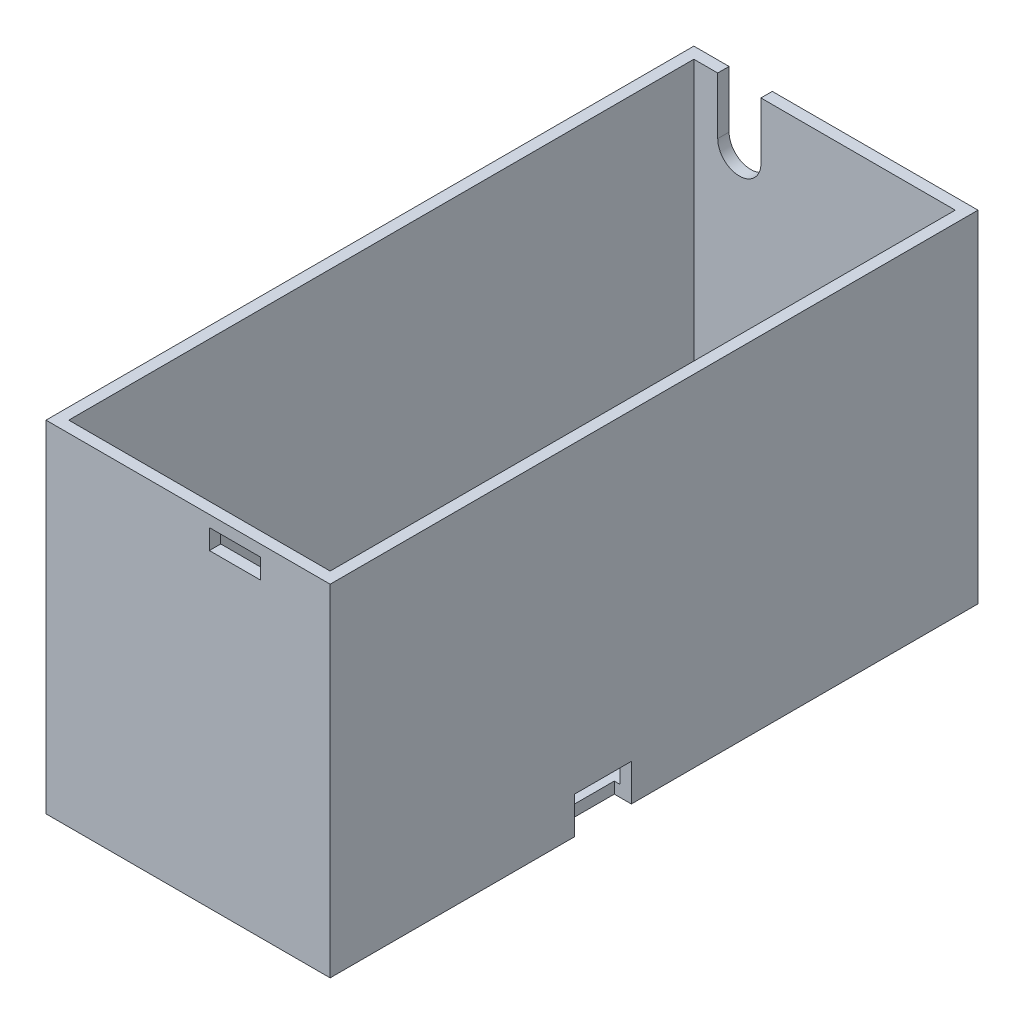
from build123d import *

# Parameters (mm, degrees)
SKIZZE1_W                       = 50
SKIZZE1_H                       = 114
AUFSATZ_LINEAR_AUSTRAGEN1_DEPTH = 60
SKIZZE2_W                       = 46
SKIZZE2_H                       = 110
SCHNITT_LINEAR_AUSTRAGEN1_DEPTH = 58
SKIZZE3_R                       = 2
AUFSATZ_LINEAR_AUSTRAGEN2_DEPTH = 15.2
SKIZZE4_R                       = 0.5
SCHNITT_LINEAR_AUSTRAGEN2_DEPTH = 5
SCHNITT_LINEAR_AUSTRAGEN3_REACH = 123.846
SKIZZE5_W                       = 15.5
SKIZZE5_H                       = 20.2
SKIZZE6_W                       = 15.5
SKIZZE6_H                       = 2
AUFSATZ_LINEAR_AUSTRAGEN3_DEPTH = 1
SCHNITT_LINEAR_AUSTRAGEN4_REACH = 123.846
SKIZZE7_W                       = 40
SKIZZE7_H                       = 3.1
FASE1_SIZE                      = 1.5
SKIZZE8_W                       = 10
SKIZZE8_H                       = 6.5
SCHNITT_LINEAR_AUSTRAGEN5_DEPTH = 3
SCHNITT_LINEAR_AUSTRAGEN6_REACH = 133.996
SKIZZE9_R                       = 3.8
SCHNITT_LINEAR_AUSTRAGEN7_REACH = 133.996
SKIZZE10_W                      = 9
SKIZZE10_H                      = 3.5


with BuildPart() as part:
    # Skizze1 → Aufsatz-Linear austragen1 (new body)
    with BuildSketch(Plane(origin=(0, 0, 0), x_dir=(1, 0, 0), z_dir=(0, 1, 0))):
        with Locations((3.757679181, -46.225255973)):
            Rectangle(SKIZZE1_W, SKIZZE1_H)
    extrude(amount=AUFSATZ_LINEAR_AUSTRAGEN1_DEPTH)

    # Skizze2 → Schnitt-Linear austragen1 (cut)
    with BuildSketch(Plane(origin=(0, 60, 0), x_dir=(1, 0, 0), z_dir=(0, 1, 0))):
        with Locations((3.757679181, -46.225255973)):
            Rectangle(SKIZZE2_W, SKIZZE2_H)
    extrude(amount=-SCHNITT_LINEAR_AUSTRAGEN1_DEPTH, mode=Mode.SUBTRACT)

    # Skizze3 → Aufsatz-Linear austragen2 (add)
    with BuildSketch(Plane(origin=(0, 2, 0), x_dir=(1, 0, 0), z_dir=(0, 1, 0))):
        with Locations(Location((-11.242320819, -24.225255973, 0), (0, 0, 90))):
            Circle(SKIZZE3_R)
        with Locations(Location((18.757679181, -24.225255973, 0), (0, 0, 90))):
            Circle(SKIZZE3_R)
        with Locations(Location((18.757679181, -96.225255973, 0), (0, 0, 90))):
            Circle(SKIZZE3_R)
        with Locations(Location((-11.242320819, -96.225255973, 0), (0, 0, 90))):
            Circle(SKIZZE3_R)
    extrude(amount=AUFSATZ_LINEAR_AUSTRAGEN2_DEPTH)

    # Skizze4 → Schnitt-Linear austragen2 (cut)
    with BuildSketch(Plane(origin=(0, 17.2, 0), x_dir=(1, 0, 0), z_dir=(0, 1, 0))):
        with Locations(Location((-11.242320819, -24.225255973, 0), (0, 0, 270))):
            Circle(SKIZZE4_R)
        with Locations(Location((18.757679181, -24.225255973, 0), (0, 0, 270))):
            Circle(SKIZZE4_R)
        with Locations(Location((18.757679181, -96.225255973, 0), (0, 0, 270))):
            Circle(SKIZZE4_R)
        with Locations(Location((-11.242320819, -96.225255973, 0), (0, 0, 270))):
            Circle(SKIZZE4_R)
    extrude(amount=-SCHNITT_LINEAR_AUSTRAGEN2_DEPTH, mode=Mode.SUBTRACT)

    # Skizze5 → Schnitt-Linear austragen3 (cut, up to next)
    with BuildSketch(Plane(origin=(0, 2, 0), x_dir=(1, 0, 0), z_dir=(0, 1, 0)), mode=Mode.PRIVATE) as schnitt_linear_austragen3_sk1:
        with Locations((3.757679181, -17.825255973)):
            Rectangle(SKIZZE5_W, SKIZZE5_H)
    schnitt_linear_austragen3_tool1 = extrude(schnitt_linear_austragen3_sk1.sketch, amount=-SCHNITT_LINEAR_AUSTRAGEN3_REACH, mode=Mode.PRIVATE) & part.part
    add(schnitt_linear_austragen3_tool1.solids().sort_by_distance((3.757679, 2, 17.825256))[0], mode=Mode.SUBTRACT)

    # Skizze6 → Aufsatz-Linear austragen3 (add)
    with BuildSketch(Plane(origin=(0, 2, 0), x_dir=(1, 0, 0), z_dir=(0, 1, 0))):
        with Locations((3.757679181, -28.925255973)):
            Rectangle(SKIZZE6_W, SKIZZE6_H)
    extrude(amount=AUFSATZ_LINEAR_AUSTRAGEN3_DEPTH)

    # Skizze7 → Schnitt-Linear austragen4 (cut, up to next)
    with BuildSketch(Plane(origin=(0, 2, 0), x_dir=(1, 0, 0), z_dir=(0, 1, 0)), mode=Mode.PRIVATE) as schnitt_linear_austragen4_sk1:
        with Locations((3.757679181, -34.775255973)):
            Rectangle(SKIZZE7_W, SKIZZE7_H)
    schnitt_linear_austragen4_tool1 = extrude(schnitt_linear_austragen4_sk1.sketch, amount=-SCHNITT_LINEAR_AUSTRAGEN4_REACH, mode=Mode.PRIVATE) & part.part
    # Skizze7 → Schnitt-Linear austragen4 (cut, up to next)
    with BuildSketch(Plane(origin=(0, 2, 0), x_dir=(1, 0, 0), z_dir=(0, 1, 0)), mode=Mode.PRIVATE) as schnitt_linear_austragen4_sk2:
        with Locations((3.757679181, -38.875255973)):
            Rectangle(SKIZZE7_W, SKIZZE7_H)
    schnitt_linear_austragen4_tool2 = extrude(schnitt_linear_austragen4_sk2.sketch, amount=-SCHNITT_LINEAR_AUSTRAGEN4_REACH, mode=Mode.PRIVATE) & part.part
    # Skizze7 → Schnitt-Linear austragen4 (cut, up to next)
    with BuildSketch(Plane(origin=(0, 2, 0), x_dir=(1, 0, 0), z_dir=(0, 1, 0)), mode=Mode.PRIVATE) as schnitt_linear_austragen4_sk3:
        with Locations((3.757679181, -42.975255973)):
            Rectangle(SKIZZE7_W, SKIZZE7_H)
    schnitt_linear_austragen4_tool3 = extrude(schnitt_linear_austragen4_sk3.sketch, amount=-SCHNITT_LINEAR_AUSTRAGEN4_REACH, mode=Mode.PRIVATE) & part.part
    # Skizze7 → Schnitt-Linear austragen4 (cut, up to next)
    with BuildSketch(Plane(origin=(0, 2, 0), x_dir=(1, 0, 0), z_dir=(0, 1, 0)), mode=Mode.PRIVATE) as schnitt_linear_austragen4_sk4:
        with Locations((3.757679181, -47.075255973)):
            Rectangle(SKIZZE7_W, SKIZZE7_H)
    schnitt_linear_austragen4_tool4 = extrude(schnitt_linear_austragen4_sk4.sketch, amount=-SCHNITT_LINEAR_AUSTRAGEN4_REACH, mode=Mode.PRIVATE) & part.part
    # Skizze7 → Schnitt-Linear austragen4 (cut, up to next)
    with BuildSketch(Plane(origin=(0, 2, 0), x_dir=(1, 0, 0), z_dir=(0, 1, 0)), mode=Mode.PRIVATE) as schnitt_linear_austragen4_sk5:
        with Locations((3.757679181, -51.175255973)):
            Rectangle(SKIZZE7_W, SKIZZE7_H)
    schnitt_linear_austragen4_tool5 = extrude(schnitt_linear_austragen4_sk5.sketch, amount=-SCHNITT_LINEAR_AUSTRAGEN4_REACH, mode=Mode.PRIVATE) & part.part
    # Skizze7 → Schnitt-Linear austragen4 (cut, up to next)
    with BuildSketch(Plane(origin=(0, 2, 0), x_dir=(1, 0, 0), z_dir=(0, 1, 0)), mode=Mode.PRIVATE) as schnitt_linear_austragen4_sk6:
        with Locations((3.757679181, -55.275255973)):
            Rectangle(SKIZZE7_W, SKIZZE7_H)
    schnitt_linear_austragen4_tool6 = extrude(schnitt_linear_austragen4_sk6.sketch, amount=-SCHNITT_LINEAR_AUSTRAGEN4_REACH, mode=Mode.PRIVATE) & part.part
    add(schnitt_linear_austragen4_tool1.solids().sort_by_distance((3.757679, 2, 34.775256))[0], mode=Mode.SUBTRACT)
    add(schnitt_linear_austragen4_tool2.solids().sort_by_distance((3.757679, 2, 38.875256))[0], mode=Mode.SUBTRACT)
    add(schnitt_linear_austragen4_tool3.solids().sort_by_distance((3.757679, 2, 42.975256))[0], mode=Mode.SUBTRACT)
    add(schnitt_linear_austragen4_tool4.solids().sort_by_distance((3.757679, 2, 47.075256))[0], mode=Mode.SUBTRACT)
    add(schnitt_linear_austragen4_tool5.solids().sort_by_distance((3.757679, 2, 51.175256))[0], mode=Mode.SUBTRACT)
    add(schnitt_linear_austragen4_tool6.solids().sort_by_distance((3.757679, 2, 55.275256))[0], mode=Mode.SUBTRACT)

    # Fase1
    fase1_edges = [part.edges().sort_by_distance(p)[0] for p in [
        (-16.242320819, 1, 36.325255973),
        (-16.242320819, 1, 33.225255973),
        (23.757679181, 1, 33.225255973),
        (23.757679181, 1, 36.325255973),
        (-16.242320819, 1, 37.325255973),
        (23.757679181, 1, 37.325255973),
        (23.757679181, 1, 40.425255973),
        (-16.242320819, 1, 40.425255973),
        (-16.242320819, 1, 41.425255973),
        (23.757679181, 1, 41.425255973),
        (23.757679181, 1, 44.525255973),
        (-16.242320819, 1, 44.525255973),
        (-16.242320819, 1, 45.525255973),
        (23.757679181, 1, 45.525255973),
        (23.757679181, 1, 48.625255973),
        (-16.242320819, 1, 48.625255973),
        (-16.242320819, 1, 49.625255973),
        (23.757679181, 1, 49.625255973),
        (23.757679181, 1, 52.725255973),
        (-16.242320819, 1, 52.725255973),
        (-16.242320819, 1, 53.725255973),
        (23.757679181, 1, 53.725255973),
        (23.757679181, 1, 56.825255973),
        (-16.242320819, 1, 56.825255973),
    ]]
    chamfer(fase1_edges, length=FASE1_SIZE)

    # Skizze8 → Schnitt-Linear austragen5 (cut)
    with BuildSketch(Plane(origin=(28.757679181, 0, 0), x_dir=(0, 0, -1), z_dir=(1, 0, 0))):
        with Locations((-55.225255973, 3.25)):
            Rectangle(SKIZZE8_W, SKIZZE8_H)
    extrude(amount=-SCHNITT_LINEAR_AUSTRAGEN5_DEPTH, mode=Mode.SUBTRACT)

    # Skizze9 → Schnitt-Linear austragen6 (cut, up to next)
    with BuildSketch(Plane(origin=(0, 0, -10.774744027), x_dir=(-1, 0, 0), z_dir=(0, 0, -1)), mode=Mode.PRIVATE) as schnitt_linear_austragen6_sk1:
        with BuildLine():
            Line((7.442320819, 60), (7.442320819, 50))
            ThreePointArc((7.442320819, 50), (11.242320819, 53.8), (15.042320819, 50))
            Line((15.042320819, 50), (15.042320819, 60))
            Line((15.042320819, 60), (7.442320819, 60))
        make_face()
    schnitt_linear_austragen6_tool1 = extrude(schnitt_linear_austragen6_sk1.sketch, amount=-SCHNITT_LINEAR_AUSTRAGEN6_REACH, mode=Mode.PRIVATE) & part.part
    # Skizze9 → Schnitt-Linear austragen6 (cut, up to next)
    with BuildSketch(Plane(origin=(0, 0, -10.774744027), x_dir=(-1, 0, 0), z_dir=(0, 0, -1)), mode=Mode.PRIVATE) as schnitt_linear_austragen6_sk2:
        with Locations((11.242320819, 50)):
            Circle(SKIZZE9_R)
    schnitt_linear_austragen6_tool2 = extrude(schnitt_linear_austragen6_sk2.sketch, amount=-SCHNITT_LINEAR_AUSTRAGEN6_REACH, mode=Mode.PRIVATE) & part.part
    add(schnitt_linear_austragen6_tool1.solids().sort_by_distance((-11.242321, 56.440988, -10.774744))[0], mode=Mode.SUBTRACT)
    add(schnitt_linear_austragen6_tool2.solids().sort_by_distance((-11.242321, 50, -10.774744))[0], mode=Mode.SUBTRACT)

    # Skizze10 → Schnitt-Linear austragen7 (cut, up to next)
    with BuildSketch(Plane.XY.offset(103.225255973), mode=Mode.PRIVATE) as schnitt_linear_austragen7_sk1:
        with Locations((12.007679181, 56.25)):
            Rectangle(SKIZZE10_W, SKIZZE10_H)
    schnitt_linear_austragen7_tool1 = extrude(schnitt_linear_austragen7_sk1.sketch, amount=-SCHNITT_LINEAR_AUSTRAGEN7_REACH, mode=Mode.PRIVATE) & part.part
    add(schnitt_linear_austragen7_tool1.solids().sort_by_distance((12.007679, 56.25, 103.225256))[0], mode=Mode.SUBTRACT)


solid = part.part
